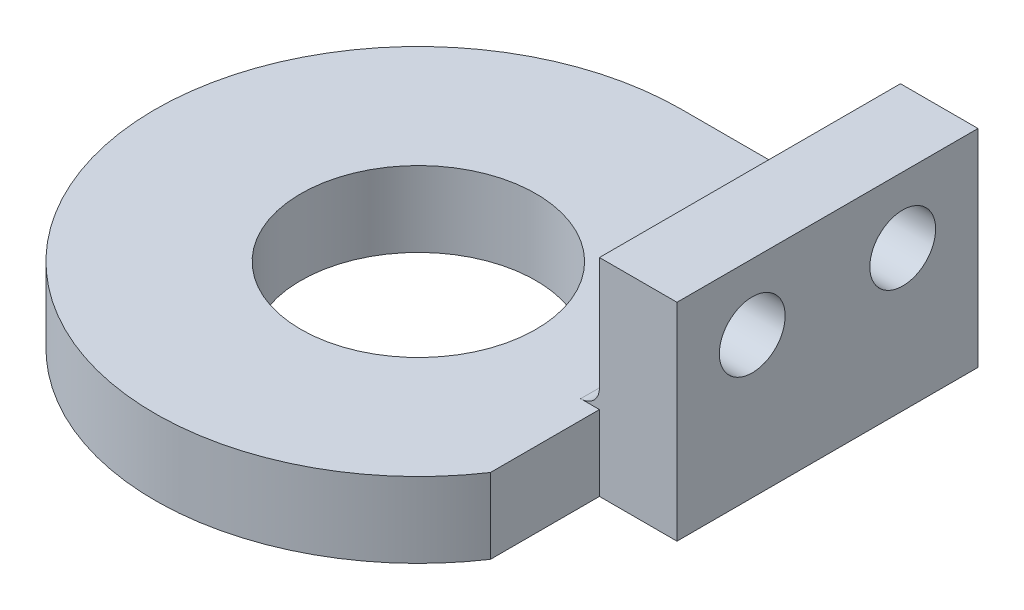
from build123d import *

# Parameters (mm, degrees)
SKETCH1_R           = 6.25
BOSS_EXTRUDE1_DEPTH = 4
SKETCH2_W           = 4.12162106
SKETCH2_H           = 16.002035265
BOSS_EXTRUDE2_DEPTH = 7
SKETCH3_R           = 1.75
CUT_EXTRUDE1_DEPTH  = 32.205988509
FILLET2_R           = 1


with BuildPart() as part:
    # Sketch1 → Boss-Extrude1 (new body)
    with BuildSketch(Plane(origin=(0, 0, 0), x_dir=(1, 0, 0), z_dir=(0, 1, 0))):
        with BuildLine():
            Line((0, 14), (15.749998278, 14))
            Line((15.749998278, 14), (15.749998278, -2.002035265))
            Line((15.749998278, -2.002035265), (11.628377218, -2.002035265))
            Line((11.628377218, -2.002035265), (11.628377218, -7.79620698))
            ThreePointArc((11.628377218, -7.79620698), (-12.352062535, -6.589882483), (0, 14))
        make_face()
        with Locations(Location((0, 0, 0), (0, 0, 270))):
            Circle(SKETCH1_R, mode=Mode.SUBTRACT)
    extrude(amount=BOSS_EXTRUDE1_DEPTH)

    # Sketch2 → Boss-Extrude2 (add)
    with BuildSketch(Plane(origin=(0, 4, 0), x_dir=(1, 0, 0), z_dir=(0, 1, 0))):
        with Locations((13.689187748, 5.998982368)):
            Rectangle(SKETCH2_W, SKETCH2_H)
    extrude(amount=BOSS_EXTRUDE2_DEPTH)

    # Sketch3 → Cut-Extrude1 (cut, through all)
    with BuildSketch(Plane.ZY.offset(-11.628377218)):
        with Locations((-1.998982368, 7.5)):
            Circle(SKETCH3_R)
        with Locations((-9.998982368, 7.5)):
            Circle(SKETCH3_R)
    extrude(amount=-CUT_EXTRUDE1_DEPTH, mode=Mode.SUBTRACT)

    # Fillet2
    fillet2_edges = [part.edges().sort_by_distance(p)[0] for p in [
        (11.628377218, 4, -5.998982368),
    ]]
    fillet(fillet2_edges, radius=FILLET2_R)


solid = part.part
